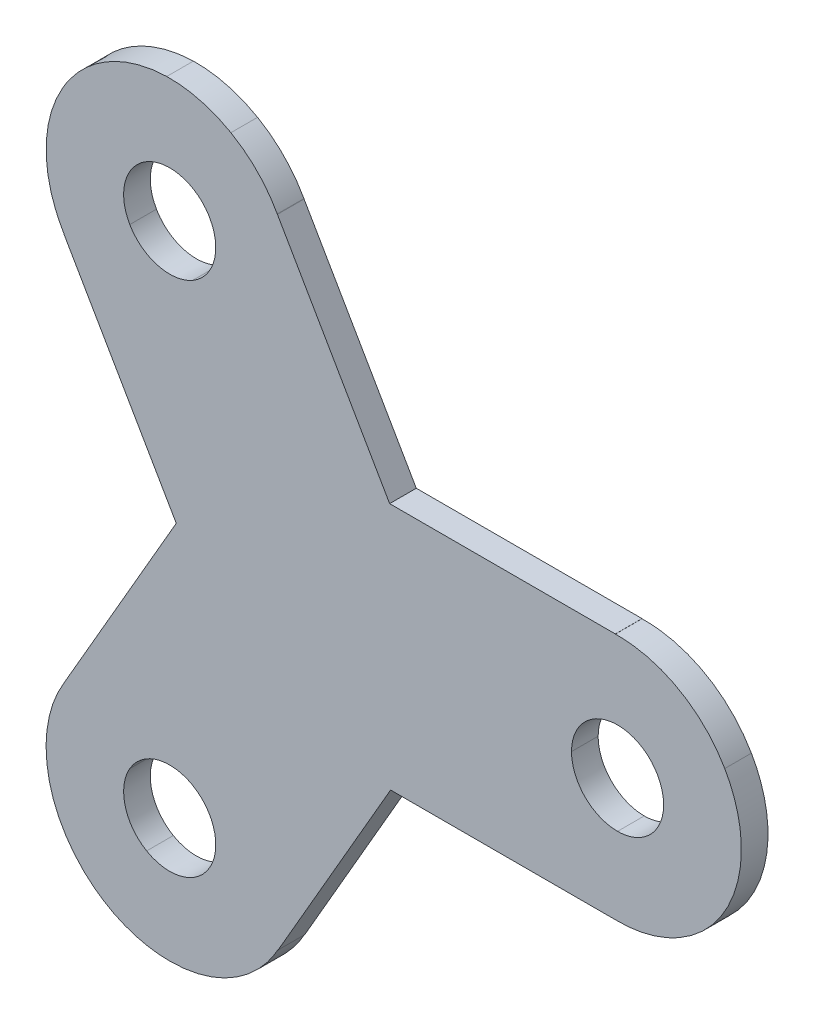
from build123d import *

# Parameters (mm, degrees)
BOSS_EXTRUDE5_DEPTH = 1.5875


with BuildPart() as part:
    # carrier → Boss-Extrude5 (new body)
    # profile 1 of 2: a face of its own
    with BuildSketch(Plane(origin=(-89.612357323, 67.458483608, 0), x_dir=(1, 0, 0), z_dir=(0, 0, 1))):
        with BuildLine():
            add(Edge.make_bspline(
                [(118.748455038, 169.468215691), (117.360345038, 167.063938691), (117.483199038, 164.211290691), (118.819010038, 161.989326691)],
                knots=[0, 0, 0, 0, 1, 1, 1, 1], degree=3))
            Line((118.819010038, 161.989326691), (118.810191038, 161.980520691))
            Line((118.810191038, 161.980520691), (125.512969038, 150.382951691))
            Line((125.512969038, 150.382951691), (118.819010038, 138.794201691))
            Line((118.819010038, 138.794201691), (118.810191038, 138.776562691))
            add(Edge.make_bspline(
                [(118.810191038, 138.776562691), (118.138894038, 137.665721691), (117.760677038, 136.367990691), (117.760677038, 134.975382691)],
                knots=[0, 0, 0, 0, 1, 1, 1, 1], degree=3))
            add(Edge.make_bspline(
                [(117.760677038, 134.975382691), (117.760675038, 130.905661691), (121.064010038, 127.602323691), (125.133733038, 127.602326691)],
                knots=[0, 0, 0, 0, 1, 1, 1, 1], degree=3))
            add(Edge.make_bspline(
                [(125.133733038, 127.602326691), (127.909953038, 127.602326691), (130.315556038, 129.144498691), (131.571927038, 131.412326691)],
                knots=[0, 0, 0, 0, 1, 1, 1, 1], degree=3))
            Line((131.571927038, 131.412326691), (131.580732038, 131.403521691))
            Line((131.580732038, 131.403521691), (138.283510038, 143.009910691))
            Line((138.283510038, 143.009910691), (151.653788038, 143.009910691))
            Line((151.653788038, 143.009910691), (151.671427038, 143.009910691))
            add(Edge.make_bspline(
                [(151.671427038, 143.009910691), (152.969090038, 142.983973691), (154.284212038, 143.301383691), (155.490246038, 143.997687691)],
                knots=[0, 0, 0, 0, 1, 1, 1, 1], degree=3))
            add(Edge.make_bspline(
                [(155.490246038, 143.997687691), (159.014728038, 146.032549691), (160.223858038, 150.545012691), (158.188996038, 154.069493691)],
                knots=[0, 0, 0, 0, 1, 1, 1, 1], degree=3))
            add(Edge.make_bspline(
                [(158.188996038, 154.069493691), (156.800886038, 156.473769691), (154.263610038, 157.793065691), (151.671427038, 157.747201691)],
                knots=[0, 0, 0, 0, 1, 1, 1, 1], degree=3))
            Line((151.671427038, 157.747201691), (151.671427038, 157.754849091))
            Line((151.671427038, 157.754849091), (138.224971754, 157.754849091))
            Line((138.224971754, 157.754849091), (131.539832754, 169.334779091))
            Line((131.539832754, 169.334779091), (131.531027754, 169.352418091))
            add(Edge.make_bspline(
                [(131.531027754, 169.352418091), (130.904660754, 170.489198091), (129.976575754, 171.469517091), (128.770540754, 172.165821091)],
                knots=[0, 0, 0, 0, 1, 1, 1, 1], degree=3))
            add(Edge.make_bspline(
                [(128.770540754, 172.165821091), (127.565708199, 172.861433534), (126.244241887, 173.179504317), (124.946928377, 173.154056045)],
                knots=[0, 0, 0, 0, 0.994463703, 0.994463703, 0.994463703, 0.994463703], degree=3))
            add(Edge.make_bspline(
                [(124.946928377, 173.154056045), (122.467005204, 173.088633853), (120.078815068, 171.772470761), (118.748455038, 169.468215691)],
                knots=[0.003756223, 0.003756223, 0.003756223, 0.003756223, 1, 1, 1, 1], degree=3))
        make_face()
        with BuildLine():
            add(Edge.make_bspline(
                [(127.49809, 133.604715), (126.740439, 132.292425), (125.062417, 131.8428), (123.750127, 132.600451)],
                knots=[0, 0, 0, 0, 1, 1, 1, 1], degree=3))
            add(Edge.make_bspline(
                [(123.750127, 132.600451), (122.437834, 133.358103), (121.988212, 135.036124), (122.745863, 136.348414)],
                knots=[0, 0, 0, 0, 1, 1, 1, 1], degree=3))
            add(Edge.make_bspline(
                [(122.745863, 136.348414), (123.503515, 137.660706), (125.181534, 138.11033), (126.493826, 137.352678)],
                knots=[0, 0, 0, 0, 1, 1, 1, 1], degree=3))
            add(Edge.make_bspline(
                [(126.493826, 137.352678), (127.806116, 136.595027), (128.255742, 134.917007), (127.49809, 133.604715)],
                knots=[0, 0, 0, 0, 1, 1, 1, 1], degree=3))
        make_face(mode=Mode.SUBTRACT)
        with BuildLine():
            Line((136.683962, 148.224924), (131.348201, 148.224924))
            add(Edge.make_bspline(
                [(130.580909, 150.385688), (130.580909, 149.56754), (130.870517, 148.814777), (131.348201, 148.224924)],
                knots=[0, 0, 0, 0, 1, 1, 1, 1], degree=3))
            add(Edge.make_bspline(
                [(131.348201, 152.537633), (130.870517, 151.94778), (130.580909, 151.203836), (130.580909, 150.385688)],
                knots=[0, 0, 0, 0, 1, 1, 1, 1], degree=3))
            Line((131.348201, 152.537633), (136.683962, 152.537633))
            add(Edge.make_bspline(
                [(137.451253, 150.385688), (137.451253, 151.203836), (137.161645, 151.94778), (136.683962, 152.537633)],
                knots=[0, 0, 0, 0, 1, 1, 1, 1], degree=3))
            add(Edge.make_bspline(
                [(136.683962, 148.224924), (137.161645, 148.814777), (137.451253, 149.56754), (137.451253, 150.385688)],
                knots=[0, 0, 0, 0, 1, 1, 1, 1], degree=3))
        make_face(mode=Mode.SUBTRACT)
        with BuildLine():
            add(Edge.make_bspline(
                [(151.803377, 153.124973), (153.318678, 153.124973), (154.547076, 151.896576), (154.547076, 150.381274)],
                knots=[0, 0, 0, 0, 1, 1, 1, 1], degree=3))
            add(Edge.make_bspline(
                [(154.547076, 150.381274), (154.547076, 148.865969), (153.318678, 147.637574), (151.803377, 147.637574)],
                knots=[0, 0, 0, 0, 1, 1, 1, 1], degree=3))
            add(Edge.make_bspline(
                [(151.803377, 147.637574), (150.288072, 147.637574), (149.059677, 148.865969), (149.059677, 150.381274)],
                knots=[0, 0, 0, 0, 1, 1, 1, 1], degree=3))
            add(Edge.make_bspline(
                [(149.059677, 150.381274), (149.059677, 151.896576), (150.288072, 153.124973), (151.803377, 153.124973)],
                knots=[0, 0, 0, 0, 1, 1, 1, 1], degree=3))
        make_face(mode=Mode.SUBTRACT)
        with BuildLine():
            add(Edge.make_bspline(
                [(122.74586, 164.414132), (121.988209, 165.726422), (122.437834, 167.404444), (123.750123, 168.162095)],
                knots=[0, 0, 0, 0, 1, 1, 1, 1], degree=3))
            add(Edge.make_bspline(
                [(123.750123, 168.162095), (125.062416, 168.919747), (126.740436, 168.470121), (127.498087, 167.157831)],
                knots=[0, 0, 0, 0, 1, 1, 1, 1], degree=3))
            add(Edge.make_bspline(
                [(127.498087, 167.157831), (128.255739, 165.845539), (127.806115, 164.16752), (126.493823, 163.409868)],
                knots=[0, 0, 0, 0, 1, 1, 1, 1], degree=3))
            add(Edge.make_bspline(
                [(126.493823, 163.409868), (125.181533, 162.652217), (123.503512, 163.101839), (122.74586, 164.414132)],
                knots=[0, 0, 0, 0, 1, 1, 1, 1], degree=3))
        make_face(mode=Mode.SUBTRACT)
    # profile 2 of 2: a face of its own
    with BuildSketch(Plane(origin=(-89.612357323, 67.458483608, 0), x_dir=(1, 0, 0), z_dir=(0, 0, 1))):
        with BuildLine():
            add(Edge.make_bspline(
                [(130.580909, 150.385688), (130.580909, 149.56754), (130.870517, 148.814777), (131.348201, 148.224924)],
                knots=[0, 0, 0, 0, 1, 1, 1, 1], degree=3))
            Line((131.348201, 148.224924), (136.683962, 148.224924))
            add(Edge.make_bspline(
                [(136.683962, 148.224924), (137.161645, 148.814777), (137.451253, 149.56754), (137.451253, 150.385688)],
                knots=[0, 0, 0, 0, 1, 1, 1, 1], degree=3))
            add(Edge.make_bspline(
                [(137.451253, 150.385688), (137.451253, 151.203836), (137.161645, 151.94778), (136.683962, 152.537633)],
                knots=[0, 0, 0, 0, 1, 1, 1, 1], degree=3))
            Line((136.683962, 152.537633), (131.348201, 152.537633))
            add(Edge.make_bspline(
                [(131.348201, 152.537633), (130.870517, 151.94778), (130.580909, 151.203836), (130.580909, 150.385688)],
                knots=[0, 0, 0, 0, 1, 1, 1, 1], degree=3))
        make_face()
    extrude(amount=BOSS_EXTRUDE5_DEPTH)


solid = part.part
